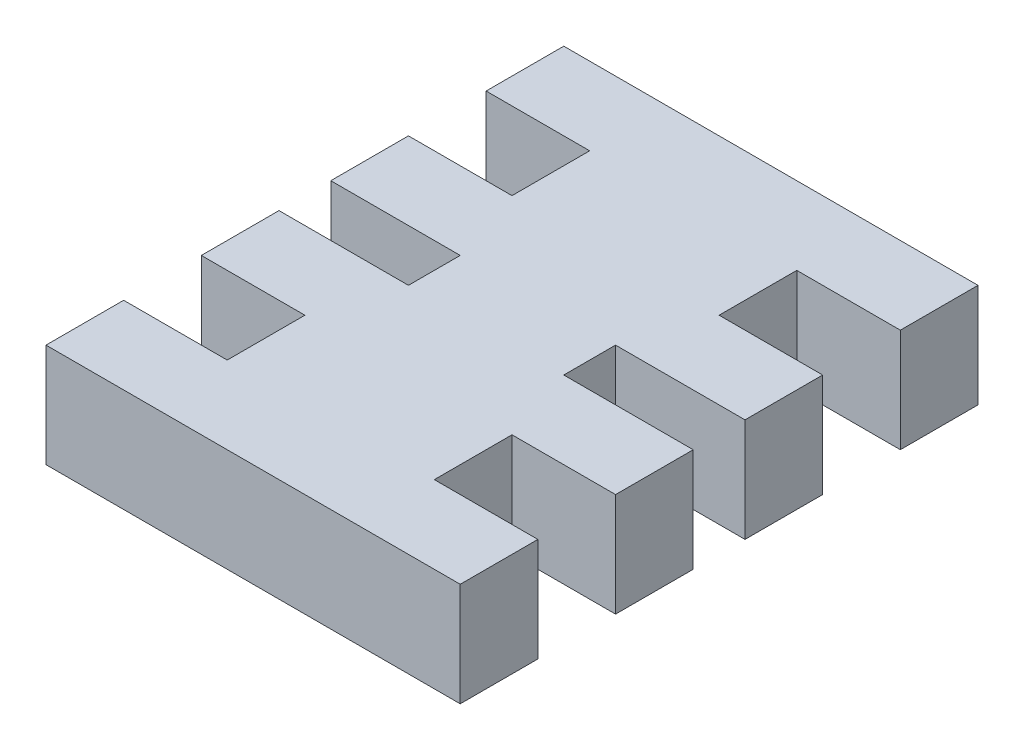
from build123d import *

# Parameters (mm, degrees)
BOSS_EXTRUDE1_DEPTH = 20


with BuildPart() as part:
    # Sketch1 → Boss-Extrude1 (new body)
    with BuildSketch(Plane(origin=(0, 0, 0), x_dir=(1, 0, 0), z_dir=(0, 1, 0))):
        Polygon((40, 55), (-40, 55), (-40, 40), (-20, 40), (-20, 25), (-40, 25), (-40, 10), (-15, 10), (-15, 0), (-40, 0), (-40, -15), (-20, -15), (-20, -30), (-40, -30), (-40, -45), (40, -45), (40, -30), (20, -30), (20, -15), (40, -15), (40, 0), (15, 0), (15, 10), (40, 10), (40, 25), (20, 25), (20, 40), (40, 40), align=None)
    extrude(amount=BOSS_EXTRUDE1_DEPTH)


solid = part.part
